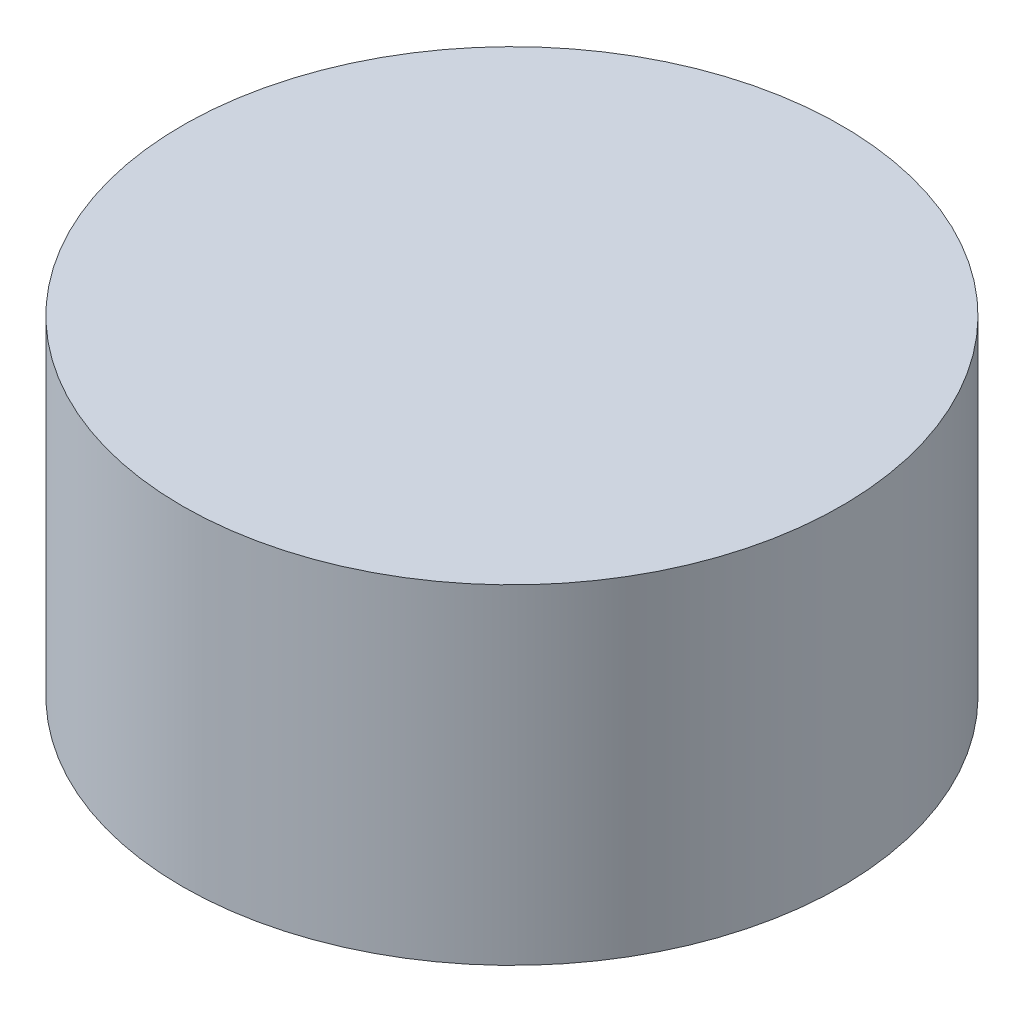
from build123d import *

# Parameters (mm, degrees)
SKETCH1_R           = 12
BOSS_EXTRUDE1_DEPTH = 12


with BuildPart() as part:
    # Sketch1 → Boss-Extrude1 (new body)
    with BuildSketch(Plane(origin=(0, 0, 0), x_dir=(1, 0, 0), z_dir=(0, 1, 0))):
        with Locations(Location((0, 0, 0), (0, 0, 270))):
            Circle(SKETCH1_R)
    extrude(amount=BOSS_EXTRUDE1_DEPTH)


solid = part.part
